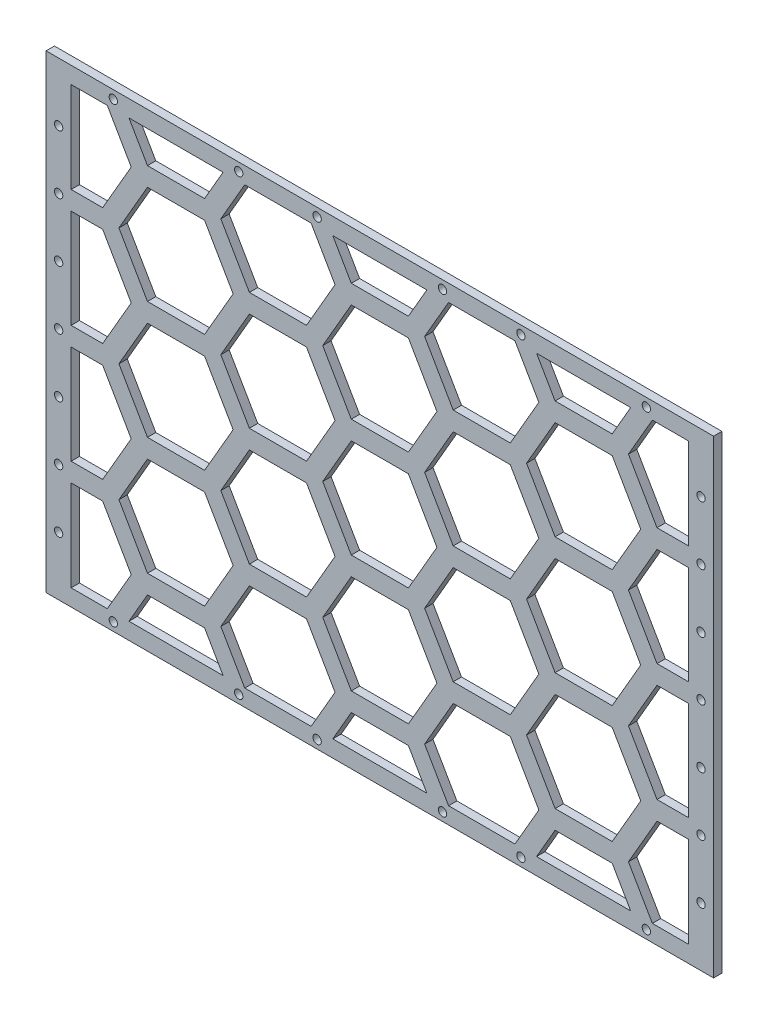
from build123d import *

# Parameters (mm, degrees)
BOSS_EXTRUDE1_DEPTH      = 0.5
BOSS_EXTRUDE1_DEPTH_BACK = 0.5
SKETCH1_W                = 80
SKETCH1_H                = 56.24252469
SKETCH1_W_2              = 74
SKETCH1_H_2              = 52.24252469
BOSS_EXTRUDE2_DEPTH      = 0.5
BOSS_EXTRUDE2_DEPTH_BACK = 0.5
SKETCH3_R                = 0.5
CUT_EXTRUDE2_DEPTH       = 1


with BuildPart() as part:
    # Sketch1 → Boss-Extrude1 (new, two sides: drawn at the far end of the back side and taken through both)
    with BuildSketch(Plane.XY.offset(-BOSS_EXTRUDE1_DEPTH_BACK)):
        Rectangle(SKETCH1_W, SKETCH1_H)
        Rectangle(SKETCH1_W_2, SKETCH1_H_2, mode=Mode.SUBTRACT)
    extrude(amount=BOSS_EXTRUDE1_DEPTH + BOSS_EXTRUDE1_DEPTH_BACK)

    # Sketch2 → Boss-Extrude2 (add, two sides: drawn at the far end of the back side and taken through both)
    with BuildSketch(Plane.XY.offset(-BOSS_EXTRUDE2_DEPTH_BACK)):
        Polygon((-37, -1.125), (-37, 1.125), (-33.220947624, 1.125), (-29.799038106, 7.051921145), (-33.220947624, 12.97884229), (-38, 12.97884229), (-38, 15.22884229), (-33.220947624, 15.22884229), (-29.799038106, 21.155763435), (-32.665870238, 26.121262345), (-30.067794026, 26.121262345), (-27.850480947, 22.280763435), (-21.00666191, 22.280763435), (-18.789348831, 26.121262345), (-16.191272619, 26.121262345), (-19.058104751, 21.155763435), (-15.636195233, 15.22884229), (-8.792376196, 15.22884229), (-5.370466677, 21.155763435), (-8.237298809, 26.121262345), (-5.639222598, 26.121262345), (-3.421909519, 22.280763435), (3.421909519, 22.280763435), (5.639222598, 26.121262345), (8.237298809, 26.121262345), (5.370466677, 21.155763435), (8.792376196, 15.22884229), (15.636195233, 15.22884229), (19.058104751, 21.155763435), (16.191272619, 26.121262345), (18.789348831, 26.121262345), (21.00666191, 22.280763435), (27.850480947, 22.280763435), (30.067794026, 26.121262345), (32.665870238, 26.121262345), (29.799038106, 21.155763435), (33.220947624, 15.22884229), (38, 15.22884229), (38, 12.97884229), (33.220947624, 12.97884229), (29.799038106, 7.051921145), (33.220947624, 1.125), (38, 1.125), (38, -1.125), (33.220947624, -1.125), (29.799038106, -7.051921145), (33.220947624, -12.97884229), (38, -12.97884229), (38, -15.22884229), (33.220947624, -15.22884229), (29.799038106, -21.155763435), (32.665870238, -26.121262345), (30.067794026, -26.121262345), (27.850480947, -22.280763435), (21.00666191, -22.280763435), (18.789348831, -26.121262345), (16.191272619, -26.121262345), (19.058104751, -21.155763435), (15.636195233, -15.22884229), (8.792376196, -15.22884229), (5.370466677, -21.155763435), (8.237298809, -26.121262345), (5.639222598, -26.121262345), (3.421909519, -22.280763435), (-3.421909519, -22.280763435), (-5.639222598, -26.121262345), (-8.237298809, -26.121262345), (-5.370466677, -21.155763435), (-8.792376196, -15.22884229), (-15.636195233, -15.22884229), (-19.058104751, -21.155763435), (-16.191272619, -26.121262345), (-18.789348831, -26.121262345), (-21.00666191, -22.280763435), (-27.850480947, -22.280763435), (-30.067794026, -26.121262345), (-32.665870238, -26.121262345), (-29.799038106, -21.155763435), (-33.220947624, -15.22884229), (-38, -15.22884229), (-38, -12.97884229), (-33.220947624, -12.97884229), (-29.799038106, -7.051921145), (-33.220947624, -1.125), align=None)
        Polygon((-31.272390466, 0), (-27.850480947, 5.926921145), (-21.00666191, 5.926921145), (-17.584752391, 0), (-21.00666191, -5.926921145), (-27.850480947, -5.926921145), align=None, mode=Mode.SUBTRACT)
        Polygon((-6.843819037, 0), (-3.421909519, 5.926921145), (3.421909519, 5.926921145), (6.843819037, 0), (3.421909519, -5.926921145), (-3.421909519, -5.926921145), align=None, mode=Mode.SUBTRACT)
        Polygon((-19.058104751, 7.051921145), (-15.636195233, 12.97884229), (-8.792376196, 12.97884229), (-5.370466677, 7.051921145), (-8.792376196, 1.125), (-15.636195233, 1.125), align=None, mode=Mode.SUBTRACT)
        Polygon((-31.272390466, 14.10384229), (-27.850480947, 20.030763435), (-21.00666191, 20.030763435), (-17.584752391, 14.10384229), (-21.00666191, 8.176921145), (-27.850480947, 8.176921145), align=None, mode=Mode.SUBTRACT)
        Polygon((-6.843819037, 14.10384229), (-3.421909519, 20.030763435), (3.421909519, 20.030763435), (6.843819037, 14.10384229), (3.421909519, 8.176921145), (-3.421909519, 8.176921145), align=None, mode=Mode.SUBTRACT)
        Polygon((-15.636195233, -1.125), (-8.792376196, -1.125), (-5.370466677, -7.051921145), (-8.792376196, -12.97884229), (-15.636195233, -12.97884229), (-19.058104751, -7.051921145), align=None, mode=Mode.SUBTRACT)
        Polygon((21.00666191, 20.030763435), (27.850480947, 20.030763435), (31.272390466, 14.10384229), (27.850480947, 8.176921145), (21.00666191, 8.176921145), (17.584752391, 14.10384229), align=None, mode=Mode.SUBTRACT)
        Polygon((8.792376196, 1.125), (5.370466677, 7.051921145), (8.792376196, 12.97884229), (15.636195233, 12.97884229), (19.058104751, 7.051921145), (15.636195233, 1.125), align=None, mode=Mode.SUBTRACT)
        Polygon((21.00666191, 5.926921145), (17.584752391, 0), (21.00666191, -5.926921145), (27.850480947, -5.926921145), (31.272390466, 0), (27.850480947, 5.926921145), align=None, mode=Mode.SUBTRACT)
        Polygon((19.058104751, -7.051921145), (15.636195233, -12.97884229), (8.792376196, -12.97884229), (5.370466677, -7.051921145), (8.792376196, -1.125), (15.636195233, -1.125), align=None, mode=Mode.SUBTRACT)
        Polygon((-3.421909519, -8.176921145), (3.421909519, -8.176921145), (6.843819037, -14.10384229), (3.421909519, -20.030763435), (-3.421909519, -20.030763435), (-6.843819037, -14.10384229), align=None, mode=Mode.SUBTRACT)
        Polygon((31.272390466, -14.10384229), (27.850480947, -20.030763435), (21.00666191, -20.030763435), (17.584752391, -14.10384229), (21.00666191, -8.176921145), (27.850480947, -8.176921145), align=None, mode=Mode.SUBTRACT)
        Polygon((-21.00666191, -20.030763435), (-27.850480947, -20.030763435), (-31.272390466, -14.10384229), (-27.850480947, -8.176921145), (-21.00666191, -8.176921145), (-17.584752391, -14.10384229), align=None, mode=Mode.SUBTRACT)
    extrude(amount=BOSS_EXTRUDE2_DEPTH + BOSS_EXTRUDE2_DEPTH_BACK)

    # Sketch3 → Cut-Extrude2 (cut)
    with BuildSketch(Plane.XY.offset(0.5)):
        with Locations((-38.5, 21.090946759)):
            Circle(SKETCH3_R)
        with Locations((-38.5, 14.060631173)):
            Circle(SKETCH3_R)
        with Locations((-38.5, 7.030315586)):
            Circle(SKETCH3_R)
        with Locations((-38.5, 0)):
            Circle(SKETCH3_R)
        with Locations((-31.944182401, 27.121262345)):
            Circle(SKETCH3_R)
        with Locations((-7.515610973, -27.121262345)):
            Circle(SKETCH3_R)
        with Locations((-16.912960456, 27.121262345)):
            Circle(SKETCH3_R)
        with Locations((-7.515610973, 27.121262345)):
            Circle(SKETCH3_R)
        with Locations((-16.912960456, -27.121262345)):
            Circle(SKETCH3_R)
        with Locations((-31.944182401, -27.121262345)):
            Circle(SKETCH3_R)
        with Locations((-38.5, -7.030315586)):
            Circle(SKETCH3_R)
        with Locations((-38.5, -14.060631173)):
            Circle(SKETCH3_R)
        with Locations((-38.5, -21.090946759)):
            Circle(SKETCH3_R)
        with Locations((7.515610973, 27.121262345)):
            Circle(SKETCH3_R)
        with Locations((16.912960456, 27.121262345)):
            Circle(SKETCH3_R)
        with Locations((31.944182401, 27.121262345)):
            Circle(SKETCH3_R)
        with Locations((38.5, 21.090946759)):
            Circle(SKETCH3_R)
        with Locations((38.5, 7.030315586)):
            Circle(SKETCH3_R)
        with Locations((38.5, 14.060631173)):
            Circle(SKETCH3_R)
        with Locations((38.5, -21.090946759)):
            Circle(SKETCH3_R)
        with Locations((38.5, -14.060631173)):
            Circle(SKETCH3_R)
        with Locations((38.5, -7.030315586)):
            Circle(SKETCH3_R)
        with Locations((31.944182401, -27.121262345)):
            Circle(SKETCH3_R)
        with Locations((16.912960456, -27.121262345)):
            Circle(SKETCH3_R)
        with Locations((7.515610973, -27.121262345)):
            Circle(SKETCH3_R)
        with Locations((38.5, 0)):
            Circle(SKETCH3_R)
    extrude(amount=-CUT_EXTRUDE2_DEPTH, mode=Mode.SUBTRACT)


solid = part.part
